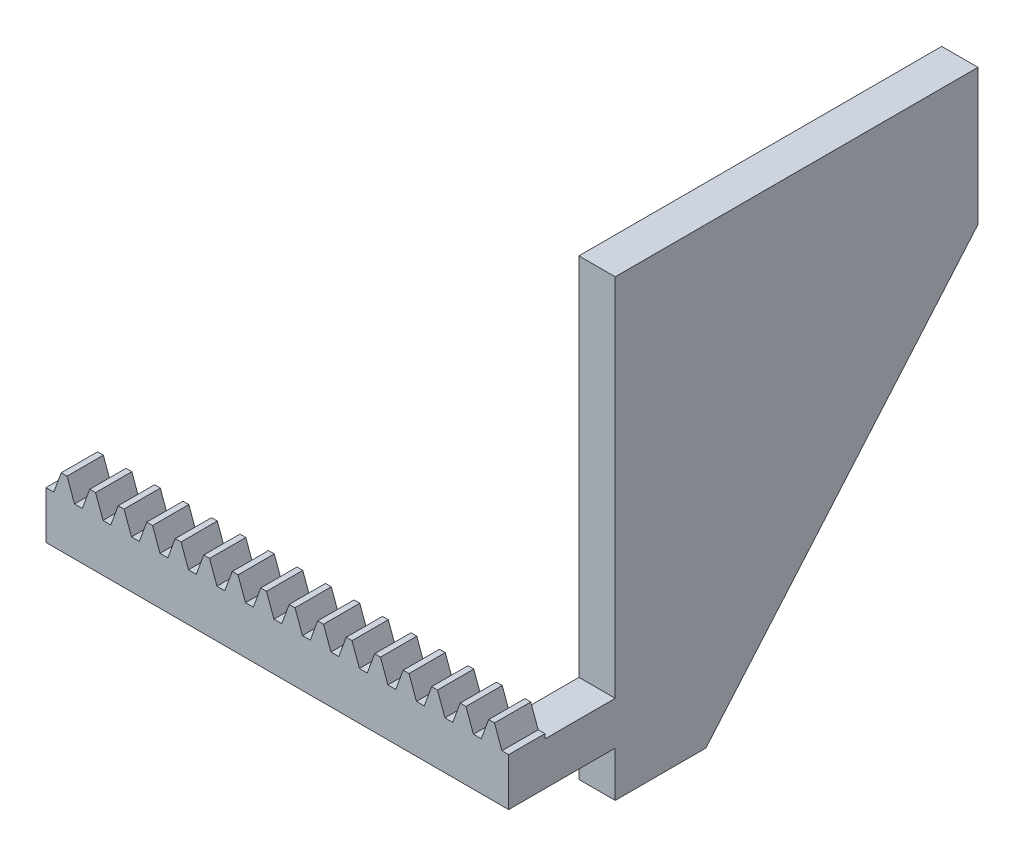
from build123d import *

# Parameters (mm, degrees)
BLANKSKE_W          = 120
BLANKSKE_H          = 16
BLANK_DEPTH         = 8
TOOTHCUTSIM_DEPTH   = 122.326007105
TEETHCUTS_COUNT     = 20
TEETHCUTS_PITCH     = 6.2831853
SKETCH1_W           = 8
SKETCH1_H           = 1
CUT_EXTRUDE1_DEPTH  = 122.326007105
BOSS_EXTRUDE2_DEPTH = 8
CUT_EXTRUDE2_DEPTH  = 183.738200713


with BuildPart() as part:
    # BlankSke → Blank (new body)
    with BuildSketch(Plane.XY):
        with Locations((60, 8)):
            Rectangle(BLANKSKE_W, BLANKSKE_H)
    extrude(amount=-BLANK_DEPTH)

    # TooCutSkeSim → ToothCutSim (cut, through all)
    with BuildSketch(Plane.XY):
        Polygon((0.861870739, 11.5), (-0.861870739, 11.5), (-2.508981637, 16.0254), (2.508981637, 16.0254), align=None)
    toothcutsim = extrude(amount=-TOOTHCUTSIM_DEPTH, mode=Mode.SUBTRACT)

    # TeethCuts: ToothCutSim ×20
    with Locations(*[(i * TEETHCUTS_PITCH, 0, 0) for i in range(1, TEETHCUTS_COUNT)]):
        add(toothcutsim, mode=Mode.SUBTRACT)

    # Sketch1 → Cut-Extrude1 (cut, through all)
    with BuildSketch(Plane(origin=(120, 0, 0), x_dir=(0, 0, -1), z_dir=(1, 0, 0))):
        with Locations((4, 0.5)):
            Rectangle(SKETCH1_W, SKETCH1_H)
    extrude(amount=-CUT_EXTRUDE1_DEPTH, mode=Mode.SUBTRACT)

    # Sketch2 → Boss-Extrude2 (add)
    with BuildSketch(Plane(origin=(120, 0, 0), x_dir=(0, 0, -1), z_dir=(1, 0, 0))):
        Polygon((8, 1), (23.5, 1), (23.5, -9), (43.5, -9), (103.5, 61), (103.5, 91), (23.5, 91), (23.5, 10.5), (8, 10.5), align=None)
    extrude(amount=-BOSS_EXTRUDE2_DEPTH)

    # Sketch3 → Cut-Extrude2 (cut, through all)
    with BuildSketch(Plane.XY):
        with BuildLine():
            Line((0, 1), (0, 11.5))
            ThreePointArc((0, 11.5), (0.43093537, 11.93093537), (0.861870739, 11.5))
            Line((0.861870739, 11.5), (2.499736794, 16))
            Line((2.499736794, 16), (3.783448506, 16))
            Line((3.783448506, 16), (5.421314561, 11.5))
            Line((5.421314561, 11.5), (7.145056039, 11.5))
            Line((7.145056039, 11.5), (8.782922094, 16))
            Line((8.782922094, 16), (10.066633806, 16))
            Line((10.066633806, 16), (11.704499861, 11.5))
            Line((11.704499861, 11.5), (13.428241339, 11.5))
            Line((13.428241339, 11.5), (15.066107394, 16))
            Line((15.066107394, 16), (15.70796325, 16))
            Line((15.70796325, 16), (16.349819106, 16))
            Line((16.349819106, 16), (17.987685161, 11.5))
            Line((17.987685161, 11.5), (17.987685161, 1))
            Line((17.987685161, 1), (15.70796325, 1))
            Line((15.70796325, 1), (6.161314561, 1))
            Line((6.161314561, 1), (0, 1))
        make_face()
    extrude(amount=-CUT_EXTRUDE2_DEPTH, mode=Mode.SUBTRACT)


solid = part.part
